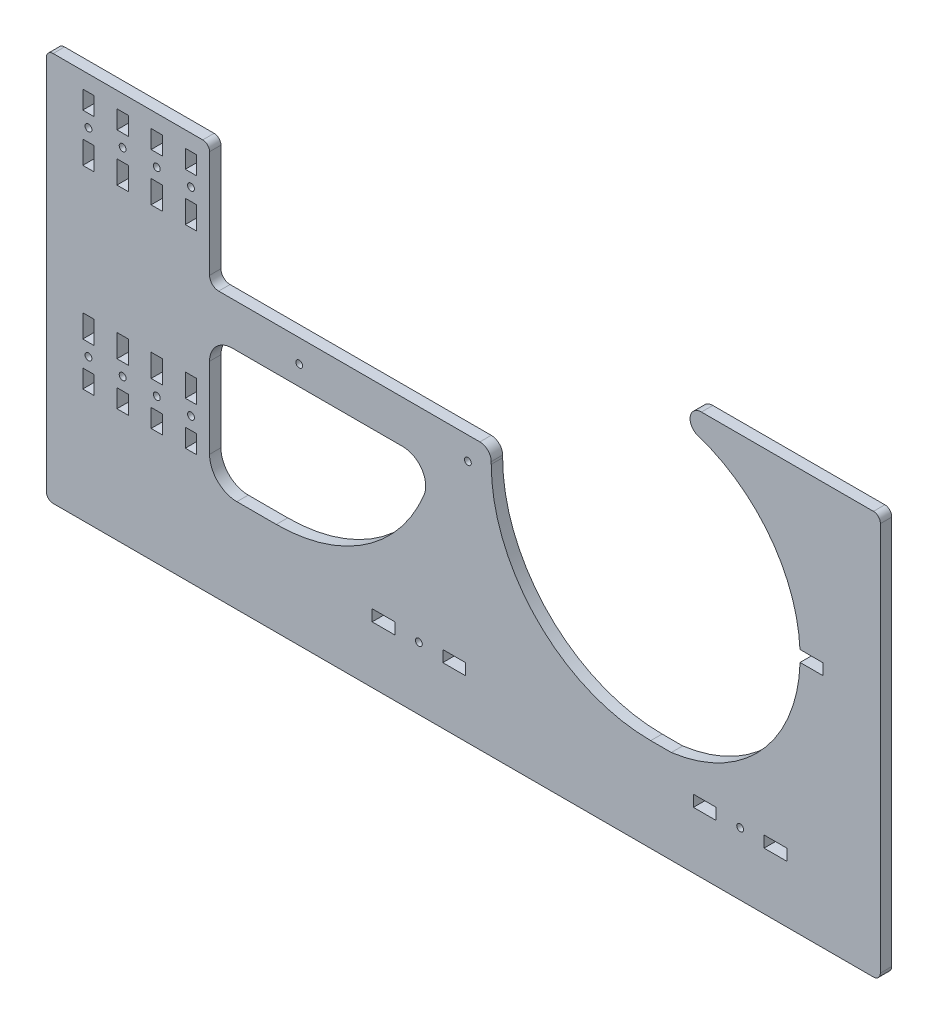
from build123d import *

# Parameters (mm, degrees)
MODEL_R                  = 1.499999966
MODEL_W                  = 5.000000075
MODEL_H                  = 8.000000119
MODEL_W_2                = 5.000000074
MODEL_H_2                = 10.000000149
MODEL_H_3                = 8.00000012
MODEL_H_4                = 9.999934109
MODEL_W_3                = 10.000000149
MODEL_H_5                = 5.000000075
RESSALTO_EXTRUS_O1_DEPTH = 5


with BuildPart() as part:
    # Model → Ressalto-extrusão1 (new body)
    with BuildSketch(Plane.XY):
        with BuildLine():
            Line((8, -12), (-351.893274345, -12))
            ThreePointArc((-351.893274345, -12), (-354.083207051, -11.160599835), (-354.999940033, -9.001896861))
            Line((-354.999940033, -9.001896861), (-354.999940033, 156.005514216))
            ThreePointArc((-354.999940033, 156.005514216), (-354.121260376, 158.126834559), (-351.999940033, 159.005514216))
            Line((-351.999940033, 159.005514216), (-286.35488426, 159.005514216))
            ThreePointArc((-286.35488426, 159.005514216), (-284.233563917, 158.126834559), (-283.35488426, 156.005514216))
            Line((-283.35488426, 156.005514216), (-283.35488426, 109.0327131))
            ThreePointArc((-283.35488426, 109.0327131), (-282.183311385, 106.204285975), (-279.35488426, 105.0327131))
            Line((-279.35488426, 105.0327131), (-240.26491068, 105.0327131))
            Line((-240.26491068, 105.0327131), (-174.726717369, 105.0327131))
            Line((-174.726717369, 105.0327131), (-164.735516671, 105.0327131))
            ThreePointArc((-164.735516671, 105.0327131), (-161.199982765, 103.568247006), (-159.735516671, 100.0327131))
            Line((-159.735516671, 100.0327131), (-159.735516671, 99.000000432))
            ThreePointArc((-159.735516671, 99.000000432), (-139.232991354, 49.502525749), (-89.735516671, 29.000000432))
            Line((-89.735516671, 29.000000432), (-80.697953904, 29.000000432))
            ThreePointArc((-80.697953904, 29.000000432), (-40.9657847, 49.85268265), (-24.211685646, 91.479354272))
            Line((-24.211685646, 91.479354272), (-14.220289858, 91.479354272))
            Line((-14.220289858, 91.479354272), (-14.220289858, 96.379354272))
            Line((-14.220289858, 96.379354272), (-24.248305583, 96.379354272))
            ThreePointArc((-24.248305583, 96.379354272), (-37.455951456, 132.806572516), (-69.044817062, 155.245995598))
            ThreePointArc((-69.044817062, 155.245995598), (-72.433921946, 160.78421234), (-67.495803781, 165))
            Line((-67.495803781, 165), (8.006839019, 165))
            ThreePointArc((8.006839019, 165), (10.19856892, 164.048492138), (11, 161.797546694))
            Line((11, 161.797546694), (11, -9))
            ThreePointArc((11, -9), (10.121320344, -11.121320344), (8, -12))
        make_face()
        with Locations((-291.500004344, 51.500000767)):
            Circle(MODEL_R, mode=Mode.SUBTRACT)
        with Locations((-291.500004344, 138.500002064)):
            Circle(MODEL_R, mode=Mode.SUBTRACT)
        with Locations((-306.500004567, 138.500002064)):
            Circle(MODEL_R, mode=Mode.SUBTRACT)
        with Locations((-336.499940034, 51.48938817)):
            Circle(MODEL_R, mode=Mode.SUBTRACT)
        with Locations((-306.500004567, 51.500000767)):
            Circle(MODEL_R, mode=Mode.SUBTRACT)
        with Locations((-336.499992479, 138.499996904)):
            Circle(MODEL_R, mode=Mode.SUBTRACT)
        with Locations((-321.500004791, 138.500002064)):
            Circle(MODEL_R, mode=Mode.SUBTRACT)
        with Locations((-321.500004791, 51.500000767)):
            Circle(MODEL_R, mode=Mode.SUBTRACT)
        with Locations((-50.500000753, 15.500000231)):
            Circle(MODEL_R, mode=Mode.SUBTRACT)
        with Locations((-170.000002533, 95.000001416)):
            Circle(MODEL_R, mode=Mode.SUBTRACT)
        with Locations((-244.000003636, 95.000001416)):
            Circle(MODEL_R, mode=Mode.SUBTRACT)
        with Locations((-191.500002854, 15.500000231)):
            Circle(MODEL_R, mode=Mode.SUBTRACT)
        with Locations((-321.500004791, 42.000000626)):
            Rectangle(MODEL_W, MODEL_H, mode=Mode.SUBTRACT)
        with Locations((-321.499939997, 147.999896164)):
            Rectangle(MODEL_W_2, MODEL_H, mode=Mode.SUBTRACT)
        with Locations((-306.499940072, 147.999896164)):
            Rectangle(MODEL_W, MODEL_H, mode=Mode.SUBTRACT)
        with Locations((-336.500005014, 62.000000924)):
            Rectangle(MODEL_W_2, MODEL_H_2, mode=Mode.SUBTRACT)
        with Locations((-336.500005014, 42.000000626)):
            Rectangle(MODEL_W_2, MODEL_H, mode=Mode.SUBTRACT)
        with Locations((-321.500004791, 62.000000924)):
            Rectangle(MODEL_W, MODEL_H_2, mode=Mode.SUBTRACT)
        with Locations((-336.499939997, 147.999896164)):
            Rectangle(MODEL_W_2, MODEL_H, mode=Mode.SUBTRACT)
        with Locations((-306.500004567, 62.000000924)):
            Rectangle(MODEL_W_2, MODEL_H_2, mode=Mode.SUBTRACT)
        with Locations((-306.500004567, 42.000000626)):
            Rectangle(MODEL_W_2, MODEL_H, mode=Mode.SUBTRACT)
        with Locations((-321.499939997, 127.999958382)):
            Rectangle(MODEL_W_2, MODEL_H_2, mode=Mode.SUBTRACT)
        with Locations((-336.499939997, 127.999958382)):
            Rectangle(MODEL_W_2, MODEL_H_2, mode=Mode.SUBTRACT)
        with Locations((-306.499940072, 127.999958382)):
            Rectangle(MODEL_W, MODEL_H_2, mode=Mode.SUBTRACT)
        with Locations((-291.499939997, 147.999896164)):
            Rectangle(MODEL_W_2, MODEL_H, mode=Mode.SUBTRACT)
        with Locations((-291.499939997, 127.999958382)):
            Rectangle(MODEL_W_2, MODEL_H_2, mode=Mode.SUBTRACT)
        with Locations((-291.499939997, 41.999963457)):
            Rectangle(MODEL_W_2, MODEL_H_3, mode=Mode.SUBTRACT)
        with Locations((-291.499939997, 61.99993092)):
            Rectangle(MODEL_W_2, MODEL_H_4, mode=Mode.SUBTRACT)
        with BuildLine():
            Line((-283.35488426, 76.35164541), (-283.35488426, 41.000000433))
            ThreePointArc((-283.35488426, 41.000000433), (-279.840165634, 32.514719058), (-271.354884259, 29.000000432))
            Line((-271.354884259, 29.000000432), (-254.058912469, 29.000000432))
            ThreePointArc((-254.058912469, 29.000000432), (-215.005187795, 40.906914879), (-189.237444794, 72.576955029))
            ThreePointArc((-189.237444794, 72.576955029), (-190.205525947, 81.94100534), (-198.52230859, 86.35164541))
            Line((-198.52230859, 86.35164541), (-273.35488426, 86.35164541))
            ThreePointArc((-273.35488426, 86.35164541), (-280.425952072, 83.422713221), (-283.35488426, 76.35164541))
        make_face(mode=Mode.SUBTRACT)
        with Locations((-66.000000537, 15.500000038)):
            Rectangle(MODEL_W_3, MODEL_H_5, mode=Mode.SUBTRACT)
        with Locations((-35.004146846, 15.500000038)):
            Rectangle(MODEL_W_3, MODEL_H_5, mode=Mode.SUBTRACT)
        with Locations((-207.000000537, 15.500000038)):
            Rectangle(MODEL_W_3, MODEL_H_5, mode=Mode.SUBTRACT)
        with Locations((-176.004146697, 15.500000038)):
            Rectangle(MODEL_W_3, MODEL_H_5, mode=Mode.SUBTRACT)
    extrude(amount=RESSALTO_EXTRUS_O1_DEPTH)


solid = part.part
